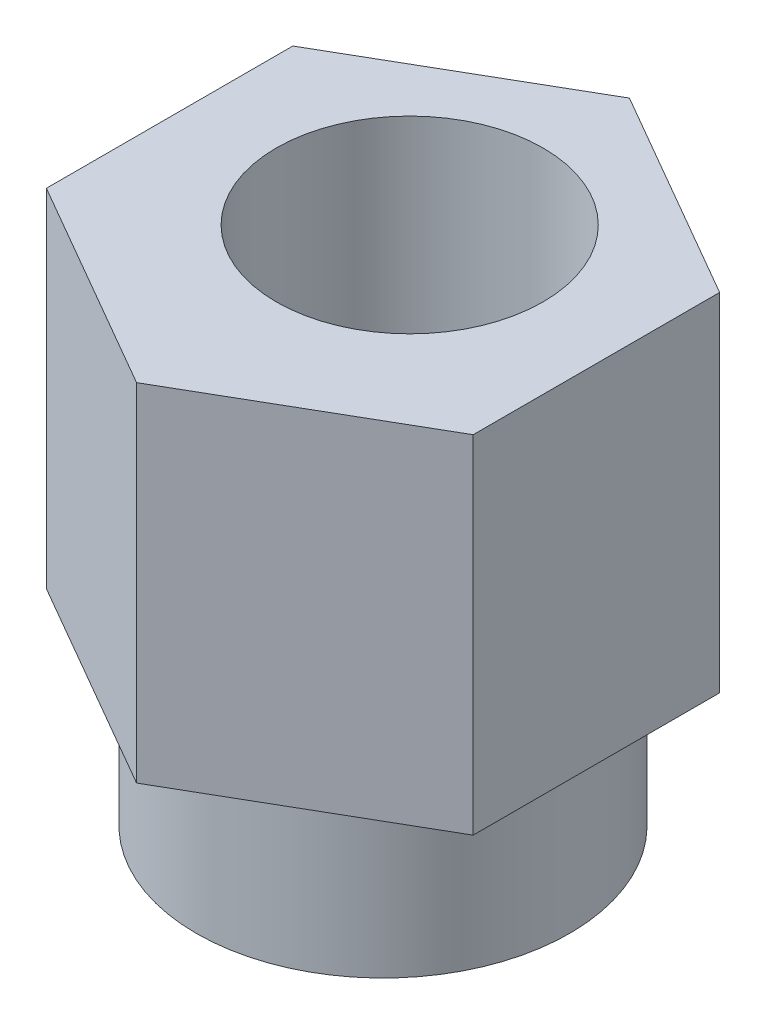
from build123d import *

# Parameters (mm, degrees)
EXTRUDE_1_DEPTH     = 6.5
SKETCH_2_R          = 3.5
SKETCH_2_R_2        = 2.5
EXTRUDE_2_DEPTH     = 3
SKETCH_2_2_R        = 2.5
CUT_EXTRUDE_1_DEPTH = 9.920949127


with BuildPart() as part:
    # Эскиз1 → Бобышка-Вытянуть1 (new body)
    with BuildSketch(Plane(origin=(0, 0, 0), x_dir=(1, 0, 0), z_dir=(0, 1, 0))):
        Polygon((0, -4.618802154), (4, -2.309401077), (4, 2.309401077), (0, 4.618802154), (-4, 2.309401077), (-4, -2.309401077), align=None)
    extrude(amount=EXTRUDE_1_DEPTH)

    # Эскиз2 → Бобышка-Вытянуть2 (add)
    with BuildSketch(Plane(origin=(0, 0, 0), x_dir=(1, 0, 0), z_dir=(0, 1, 0))):
        Circle(SKETCH_2_R)
        with Locations((0, 0.5)):
            Circle(SKETCH_2_R_2, mode=Mode.SUBTRACT)
    extrude(amount=-EXTRUDE_2_DEPTH)

    # Эскиз2<2> → Вырез-Вытянуть1 (cut, through all)
    with BuildSketch(Plane(origin=(0, 0, 0), x_dir=(1, 0, 0), z_dir=(0, 1, 0))):
        with Locations((0, 0.5)):
            Circle(SKETCH_2_2_R)
    extrude(amount=CUT_EXTRUDE_1_DEPTH, mode=Mode.SUBTRACT)


solid = part.part
